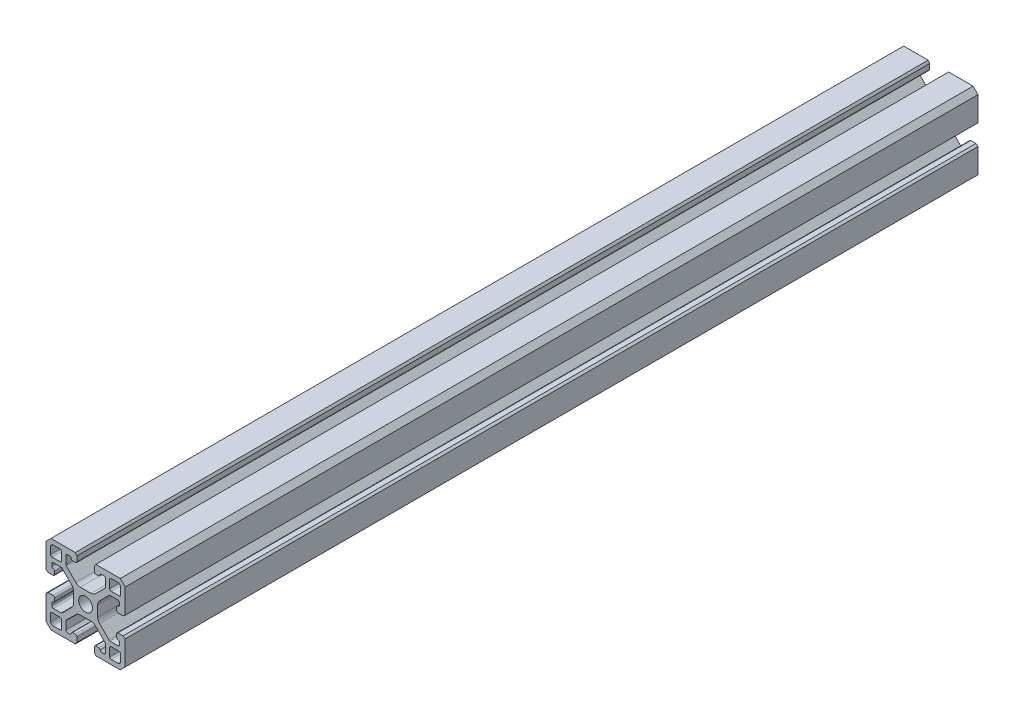
from build123d import *

# Parameters (mm, degrees)
SKETCH1_R           = 3.3147
BOSS_EXTRUDE1_DEPTH = 410.21


with BuildPart() as part:
    # Sketch1 → Boss-Extrude1 (new body)
    with BuildSketch(Plane(origin=(0, 0, 0), x_dir=(-1, 0, 0), z_dir=(0, 0, 1))):
        with BuildLine():
            Line((-19.05, 4.9276), (-19.05, 16.6878))
            Line((-19.05, 16.6878), (-16.6878, 19.05))
            Line((-16.6878, 19.05), (-4.9276, 19.05))
            Line((-4.9276, 19.05), (-4.1656, 18.044024186))
            Line((-4.1656, 18.044024186), (-4.1656, 15.669241304))
            ThreePointArc((-4.1656, 15.669241304), (-4.393507141, 15.125744462), (-4.940898734, 14.90735736))
            Line((-4.940898734, 14.90735736), (-6.223767748, 14.929749922))
            ThreePointArc((-6.223767748, 14.929749922), (-6.718113097, 15.123354458), (-6.966034507, 15.592816933))
            ThreePointArc((-6.966034507, 15.592816933), (-7.218934357, 16.066687743), (-7.7216, 16.256))
            Line((-7.7216, 16.256), (-8.763, 16.256))
            ThreePointArc((-8.763, 16.256), (-9.301815367, 16.032815367), (-9.525, 15.494))
            Line((-9.525, 15.494), (-9.525, 11.816287081))
            ThreePointArc((-9.525, 11.816287081), (-9.466996204, 11.524682306), (-9.301815367, 11.277471714))
            Line((-9.301815367, 11.277471714), (-4.7244731, 6.700129446))
            ThreePointArc((-4.7244731, 6.700129446), (-3.735630732, 6.0394061), (-2.569211631, 5.807390915))
            Line((-2.569211631, 5.807390915), (2.569211631, 5.807390915))
            ThreePointArc((2.569211631, 5.807390915), (3.735630732, 6.0394061), (4.7244731, 6.700129446))
            Line((4.7244731, 6.700129446), (9.301815367, 11.277471714))
            ThreePointArc((9.301815367, 11.277471714), (9.466996204, 11.524682306), (9.525, 11.816287081))
            Line((9.525, 11.816287081), (9.525, 15.494))
            ThreePointArc((9.525, 15.494), (9.301815367, 16.032815367), (8.763, 16.256))
            Line((8.763, 16.256), (7.7216, 16.256))
            ThreePointArc((7.7216, 16.256), (7.218934357, 16.066687743), (6.966034507, 15.592816933))
            ThreePointArc((6.966034507, 15.592816933), (6.718113097, 15.123354458), (6.223767748, 14.929749922))
            Line((6.223767748, 14.929749922), (4.940898734, 14.90735736))
            ThreePointArc((4.940898734, 14.90735736), (4.393507141, 15.125744462), (4.1656, 15.669241304))
            Line((4.1656, 15.669241304), (4.1656, 18.044024186))
            Line((4.1656, 18.044024186), (4.9276, 19.05))
            Line((4.9276, 19.05), (16.6878, 19.05))
            Line((16.6878, 19.05), (19.05, 16.6878))
            Line((19.05, 16.6878), (19.05, 4.9276))
            Line((19.05, 4.9276), (18.044024186, 4.1656))
            Line((18.044024186, 4.1656), (15.669241304, 4.1656))
            ThreePointArc((15.669241304, 4.1656), (15.125744462, 4.393507141), (14.90735736, 4.940898734))
            Line((14.90735736, 4.940898734), (14.929749922, 6.223767748))
            ThreePointArc((14.929749922, 6.223767748), (15.123354458, 6.718113097), (15.592816933, 6.966034507))
            ThreePointArc((15.592816933, 6.966034507), (16.066687743, 7.218934357), (16.256, 7.7216))
            Line((16.256, 7.7216), (16.256, 8.763))
            ThreePointArc((16.256, 8.763), (16.032815367, 9.301815367), (15.494, 9.525))
            Line((15.494, 9.525), (11.816287081, 9.525))
            ThreePointArc((11.816287081, 9.525), (11.524682306, 9.466996204), (11.277471714, 9.301815367))
            Line((11.277471714, 9.301815367), (6.700129446, 4.7244731))
            ThreePointArc((6.700129446, 4.7244731), (6.0394061, 3.735630732), (5.807390915, 2.569211631))
            Line((5.807390915, 2.569211631), (5.807390915, -2.569211631))
            ThreePointArc((5.807390915, -2.569211631), (6.0394061, -3.735630732), (6.700129446, -4.7244731))
            Line((6.700129446, -4.7244731), (11.277471714, -9.301815367))
            ThreePointArc((11.277471714, -9.301815367), (11.524682306, -9.466996204), (11.816287081, -9.525))
            Line((11.816287081, -9.525), (15.494, -9.525))
            ThreePointArc((15.494, -9.525), (16.032815367, -9.301815367), (16.256, -8.763))
            Line((16.256, -8.763), (16.256, -7.7216))
            ThreePointArc((16.256, -7.7216), (16.066687743, -7.218934357), (15.592816933, -6.966034507))
            ThreePointArc((15.592816933, -6.966034507), (15.123354458, -6.718113097), (14.929749922, -6.223767748))
            Line((14.929749922, -6.223767748), (14.90735736, -4.940898734))
            ThreePointArc((14.90735736, -4.940898734), (15.125744462, -4.393507141), (15.669241304, -4.1656))
            Line((15.669241304, -4.1656), (18.044024186, -4.1656))
            Line((18.044024186, -4.1656), (19.05, -4.9276))
            Line((19.05, -4.9276), (19.05, -16.6878))
            Line((19.05, -16.6878), (16.6878, -19.05))
            Line((16.6878, -19.05), (4.940898734, -19.05))
            Line((4.940898734, -19.05), (4.1656, -18.044024186))
            Line((4.1656, -18.044024186), (4.1656, -15.669241304))
            ThreePointArc((4.1656, -15.669241304), (4.393507141, -15.125744462), (4.940898734, -14.90735736))
            Line((4.940898734, -14.90735736), (6.223767748, -14.929749922))
            ThreePointArc((6.223767748, -14.929749922), (6.718113097, -15.123354458), (6.966034507, -15.592816933))
            ThreePointArc((6.966034507, -15.592816933), (7.218934357, -16.066687743), (7.7216, -16.256))
            Line((7.7216, -16.256), (8.763, -16.256))
            ThreePointArc((8.763, -16.256), (9.301815367, -16.032815367), (9.525, -15.494))
            Line((9.525, -15.494), (9.525, -11.816287081))
            ThreePointArc((9.525, -11.816287081), (9.466996204, -11.524682306), (9.301815367, -11.277471714))
            Line((9.301815367, -11.277471714), (4.7244731, -6.700129446))
            ThreePointArc((4.7244731, -6.700129446), (3.735630732, -6.0394061), (2.569211631, -5.807390915))
            Line((2.569211631, -5.807390915), (-2.569211631, -5.807390915))
            ThreePointArc((-2.569211631, -5.807390915), (-3.735630732, -6.0394061), (-4.7244731, -6.700129446))
            Line((-4.7244731, -6.700129446), (-9.301815367, -11.277471714))
            ThreePointArc((-9.301815367, -11.277471714), (-9.466996204, -11.524682306), (-9.525, -11.816287081))
            Line((-9.525, -11.816287081), (-9.525, -15.494))
            ThreePointArc((-9.525, -15.494), (-9.301815367, -16.032815367), (-8.763, -16.256))
            Line((-8.763, -16.256), (-7.7216, -16.256))
            ThreePointArc((-7.7216, -16.256), (-7.218934357, -16.066687743), (-6.966034507, -15.592816933))
            ThreePointArc((-6.966034507, -15.592816933), (-6.718113097, -15.123354458), (-6.223767748, -14.929749922))
            Line((-6.223767748, -14.929749922), (-4.940898734, -14.90735736))
            ThreePointArc((-4.940898734, -14.90735736), (-4.393507141, -15.125744462), (-4.1656, -15.669241304))
            Line((-4.1656, -15.669241304), (-4.1656, -18.044024186))
            Line((-4.1656, -18.044024186), (-4.9276, -19.05))
            Line((-4.9276, -19.05), (-16.6878, -19.05))
            Line((-16.6878, -19.05), (-19.05, -16.6878))
            Line((-19.05, -16.6878), (-19.05, -4.9276))
            Line((-19.05, -4.9276), (-18.044024186, -4.1656))
            Line((-18.044024186, -4.1656), (-15.669241304, -4.1656))
            ThreePointArc((-15.669241304, -4.1656), (-15.125744462, -4.393507141), (-14.90735736, -4.940898734))
            Line((-14.90735736, -4.940898734), (-14.929749922, -6.223767748))
            ThreePointArc((-14.929749922, -6.223767748), (-15.123354458, -6.718113097), (-15.592816933, -6.966034507))
            ThreePointArc((-15.592816933, -6.966034507), (-16.066687743, -7.218934357), (-16.256, -7.7216))
            Line((-16.256, -7.7216), (-16.256, -8.763))
            ThreePointArc((-16.256, -8.763), (-16.032815367, -9.301815367), (-15.494, -9.525))
            Line((-15.494, -9.525), (-11.816287081, -9.525))
            ThreePointArc((-11.816287081, -9.525), (-11.524682306, -9.466996204), (-11.277471714, -9.301815367))
            Line((-11.277471714, -9.301815367), (-6.700129446, -4.7244731))
            ThreePointArc((-6.700129446, -4.7244731), (-6.0394061, -3.735630732), (-5.807390915, -2.569211631))
            Line((-5.807390915, -2.569211631), (-5.807390915, 2.569211631))
            ThreePointArc((-5.807390915, 2.569211631), (-6.0394061, 3.735630732), (-6.700129446, 4.7244731))
            Line((-6.700129446, 4.7244731), (-11.277471714, 9.301815367))
            ThreePointArc((-11.277471714, 9.301815367), (-11.524682306, 9.466996204), (-11.816287081, 9.525))
            Line((-11.816287081, 9.525), (-15.494, 9.525))
            ThreePointArc((-15.494, 9.525), (-16.032815367, 9.301815367), (-16.256, 8.763))
            Line((-16.256, 8.763), (-16.256, 7.7216))
            ThreePointArc((-16.256, 7.7216), (-16.066687743, 7.218934357), (-15.592816933, 6.966034507))
            ThreePointArc((-15.592816933, 6.966034507), (-15.123354458, 6.718113097), (-14.929749922, 6.223767748))
            Line((-14.929749922, 6.223767748), (-14.90735736, 4.940898734))
            ThreePointArc((-14.90735736, 4.940898734), (-15.125744462, 4.393507141), (-15.669241304, 4.1656))
            Line((-15.669241304, 4.1656), (-18.044024186, 4.1656))
            Line((-18.044024186, 4.1656), (-19.05, 4.9276))
        make_face()
        with Locations(Location((0, 0, 0), (0, 0, 180))):
            Circle(SKETCH1_R, mode=Mode.SUBTRACT)
        with BuildLine():
            Line((-16.8656, 12.319), (-16.8656, 15.682887307))
            ThreePointArc((-16.8656, 15.682887307), (-16.807596204, 15.974492082), (-16.642415367, 16.221702674))
            Line((-16.642415367, 16.221702674), (-16.221702674, 16.642415367))
            ThreePointArc((-16.221702674, 16.642415367), (-15.974492082, 16.807596204), (-15.682887307, 16.8656))
            Line((-15.682887307, 16.8656), (-12.319, 16.8656))
            ThreePointArc((-12.319, 16.8656), (-11.780184633, 16.642415367), (-11.557, 16.1036))
            Line((-11.557, 16.1036), (-11.557, 12.319))
            ThreePointArc((-11.557, 12.319), (-11.780184633, 11.780184633), (-12.319, 11.557))
            Line((-12.319, 11.557), (-16.1036, 11.557))
            ThreePointArc((-16.1036, 11.557), (-16.642415367, 11.780184633), (-16.8656, 12.319))
        make_face(mode=Mode.SUBTRACT)
        with BuildLine():
            Line((-16.1036, -11.557), (-12.319, -11.557))
            ThreePointArc((-12.319, -11.557), (-11.780184633, -11.780184633), (-11.557, -12.319))
            Line((-11.557, -12.319), (-11.557, -16.1036))
            ThreePointArc((-11.557, -16.1036), (-11.780184633, -16.642415367), (-12.319, -16.8656))
            Line((-12.319, -16.8656), (-15.682887307, -16.8656))
            ThreePointArc((-15.682887307, -16.8656), (-15.974492082, -16.807596204), (-16.221702674, -16.642415367))
            Line((-16.221702674, -16.642415367), (-16.642415367, -16.221702674))
            ThreePointArc((-16.642415367, -16.221702674), (-16.807596204, -15.974492082), (-16.8656, -15.682887307))
            Line((-16.8656, -15.682887307), (-16.8656, -12.319))
            ThreePointArc((-16.8656, -12.319), (-16.642415367, -11.780184633), (-16.1036, -11.557))
        make_face(mode=Mode.SUBTRACT)
        with BuildLine():
            Line((15.682887307, -16.8656), (12.319, -16.8656))
            ThreePointArc((12.319, -16.8656), (11.780184633, -16.642415367), (11.557, -16.1036))
            Line((11.557, -16.1036), (11.557, -12.319))
            ThreePointArc((11.557, -12.319), (11.780184633, -11.780184633), (12.319, -11.557))
            Line((12.319, -11.557), (16.1036, -11.557))
            ThreePointArc((16.1036, -11.557), (16.642415367, -11.780184633), (16.8656, -12.319))
            Line((16.8656, -12.319), (16.8656, -15.682887307))
            ThreePointArc((16.8656, -15.682887307), (16.807596204, -15.974492082), (16.642415367, -16.221702674))
            Line((16.642415367, -16.221702674), (16.221702674, -16.642415367))
            ThreePointArc((16.221702674, -16.642415367), (15.974492082, -16.807596204), (15.682887307, -16.8656))
        make_face(mode=Mode.SUBTRACT)
        with BuildLine():
            Line((11.557, 12.319), (11.557, 16.1036))
            ThreePointArc((11.557, 16.1036), (11.780184633, 16.642415367), (12.319, 16.8656))
            Line((12.319, 16.8656), (15.682887307, 16.8656))
            ThreePointArc((15.682887307, 16.8656), (15.974492082, 16.807596204), (16.221702674, 16.642415367))
            Line((16.221702674, 16.642415367), (16.642415367, 16.221702674))
            ThreePointArc((16.642415367, 16.221702674), (16.807596204, 15.974492082), (16.8656, 15.682887307))
            Line((16.8656, 15.682887307), (16.8656, 12.319))
            ThreePointArc((16.8656, 12.319), (16.642415367, 11.780184633), (16.1036, 11.557))
            Line((16.1036, 11.557), (12.319, 11.557))
            ThreePointArc((12.319, 11.557), (11.780184633, 11.780184633), (11.557, 12.319))
        make_face(mode=Mode.SUBTRACT)
    extrude(amount=BOSS_EXTRUDE1_DEPTH)


solid = part.part
